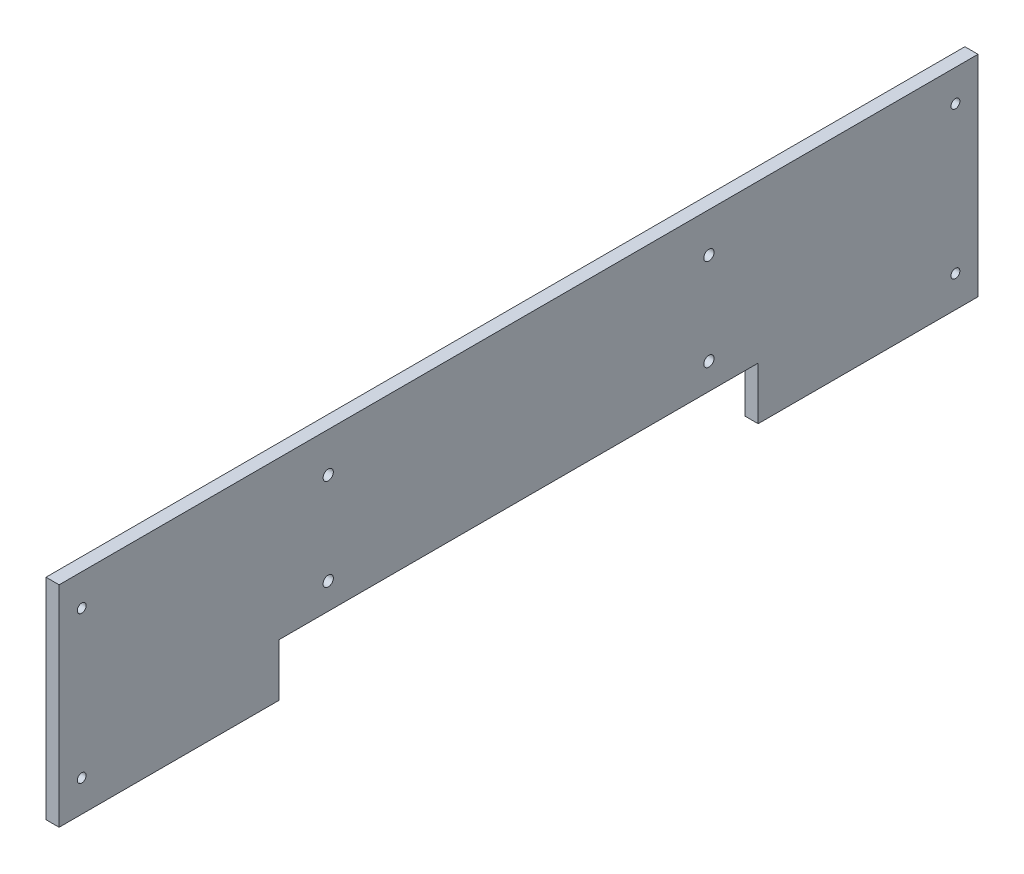
from build123d import *

# Parameters (mm, degrees)
SKETCH1_W              = 444.5
SKETCH1_H              = 101.6
BOSS_EXTRUDE1_DEPTH    = 6.35
F_10_CLEARANCE_HOLE1_D = 4.9784
F_8_CLEARANCE_HOLE1_D  = 4.3053
SKETCH12_W             = 231.775
SKETCH12_H             = 25.4
CUT_EXTRUDE2_DEPTH     = 229.07021945


with BuildPart() as part:
    # Sketch1 → Boss-Extrude1 (new body)
    with BuildSketch(Plane(origin=(0, 0, 0), x_dir=(0, 0, -1), z_dir=(1, 0, 0))):
        Rectangle(SKETCH1_W, SKETCH1_H)
    extrude(amount=BOSS_EXTRUDE1_DEPTH)

    # #10 Clearance Hole1 (through all)
    with Locations(Plane(origin=(6.35, 0, 0), x_dir=(0, 0, -1), z_dir=(1, 0, 0))):
        with Locations((92.075, 31.75), (92.075, -12.7), (-92.075, 31.75), (-92.075, -12.7)):
            Hole(F_10_CLEARANCE_HOLE1_D / 2)

    # #8 Clearance Hole1 (through all)
    with Locations(Plane(origin=(6.35, 0, 0), x_dir=(0, 0, -1), z_dir=(1, 0, 0))):
        with Locations((-211.328, 35.56), (-211.328, -35.56), (211.328, -35.56), (211.328, 35.56)):
            Hole(F_8_CLEARANCE_HOLE1_D / 2)

    # Sketch12 → Cut-Extrude2 (cut, through all)
    with BuildSketch(Plane(origin=(6.35, 0, 0), x_dir=(0, 0, -1), z_dir=(1, 0, 0))):
        with Locations((0, -38.1)):
            Rectangle(SKETCH12_W, SKETCH12_H)
    extrude(amount=-CUT_EXTRUDE2_DEPTH, mode=Mode.SUBTRACT)


solid = part.part
